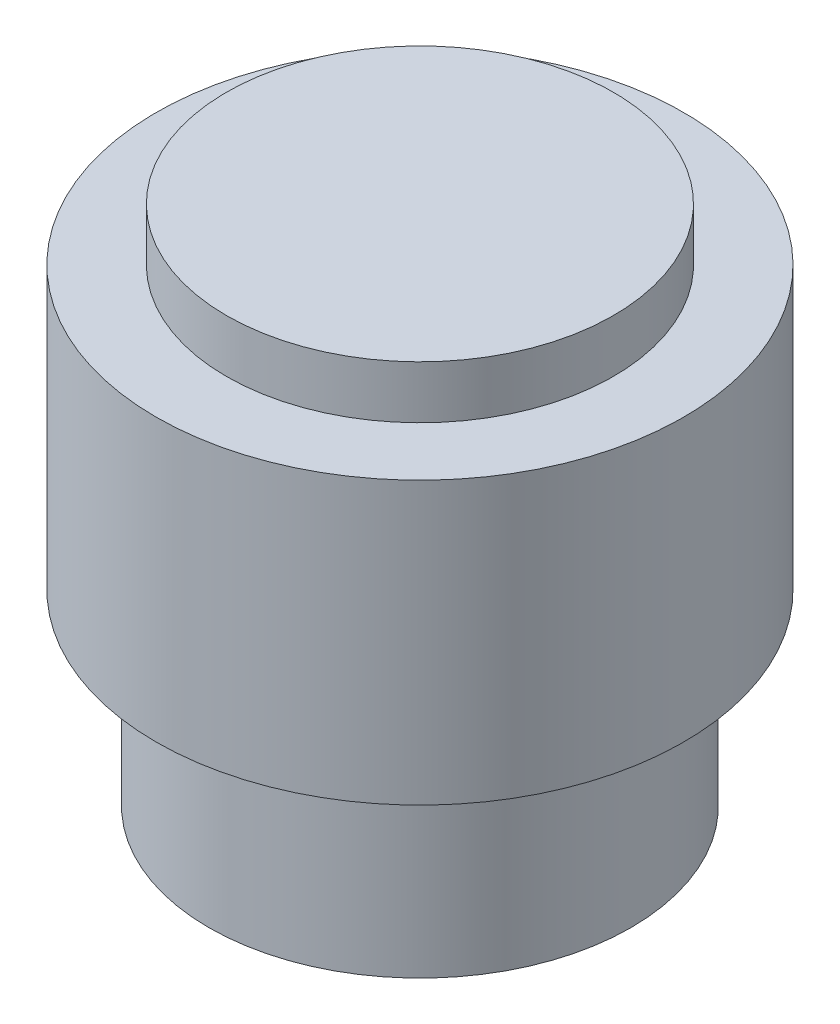
from build123d import *

# Parameters (mm, degrees)
THREAD_START        = -3.5
SKETCH1_R           = 6
THREAD_DEPTH        = 5.33
BODY_START          = 1.82
SKETCH2_R           = 7.5
BODY_DEPTH          = 8
FRONT_START         = 9.81
SKETCH3_R           = 5.5
FRONT_ELEMENT_DEPTH = 1.51


with BuildPart() as part:
    # Sketch1 → Thread (new body)
    with BuildSketch(Plane(origin=(0, 0, 0), x_dir=(1, 0, 0), z_dir=(0, 1, 0)).offset(THREAD_START)):
        with Locations(Location((0, 0, 0), (0, 0, 270))):
            Circle(SKETCH1_R)
    extrude(amount=THREAD_DEPTH)

    # Sketch2 → Body (add)
    with BuildSketch(Plane(origin=(0, 0, 0), x_dir=(1, 0, 0), z_dir=(0, 1, 0)).offset(BODY_START)):
        with Locations(Location((0, 0, 0), (0, 0, 270))):
            Circle(SKETCH2_R)
    extrude(amount=BODY_DEPTH)

    # Sketch3 → Front element (add)
    with BuildSketch(Plane(origin=(0, 0, 0), x_dir=(1, 0, 0), z_dir=(0, 1, 0)).offset(FRONT_START)):
        with Locations(Location((0, 0, 0), (0, 0, 270))):
            Circle(SKETCH3_R)
    extrude(amount=FRONT_ELEMENT_DEPTH)


solid = part.part
